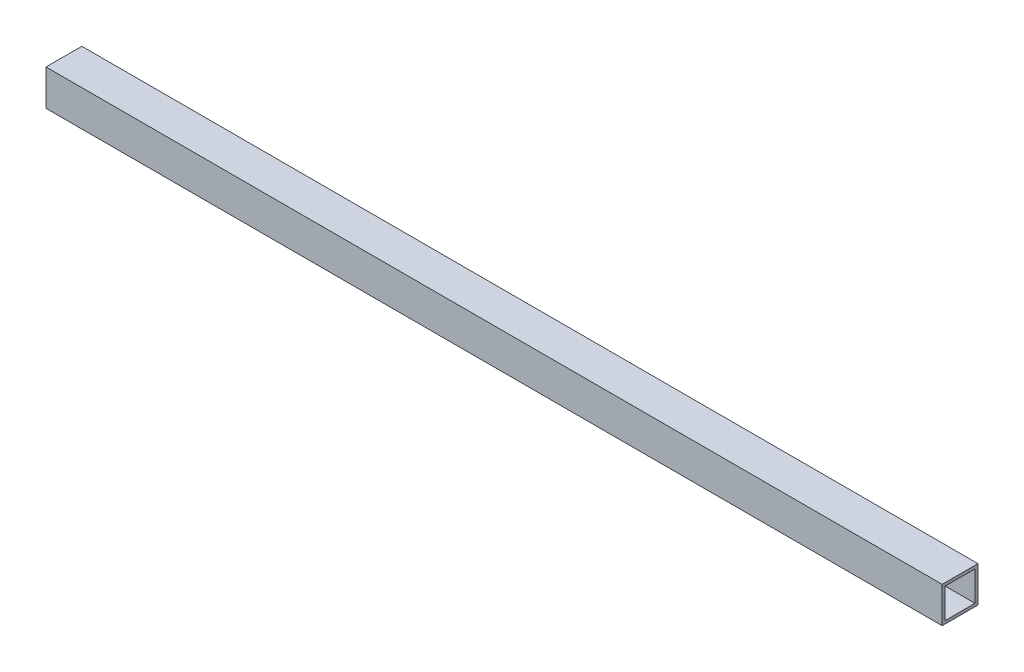
from build123d import *

# Parameters (mm, degrees)
SKETCH_2_W      = 24
SKETCH_2_H      = 24
SKETCH_2_W_2    = 20
SKETCH_2_H_2    = 20
EXTRUDE_3_DEPTH = 600


with BuildPart() as part:
    # 草图2 → 凸台-拉伸3 (new body)
    with BuildSketch(Plane(origin=(0, 0, 0), x_dir=(0, 0, -1), z_dir=(1, 0, 0))):
        Rectangle(SKETCH_2_W, SKETCH_2_H)
        Rectangle(SKETCH_2_W_2, SKETCH_2_H_2, mode=Mode.SUBTRACT)
    extrude(amount=EXTRUDE_3_DEPTH)


solid = part.part
